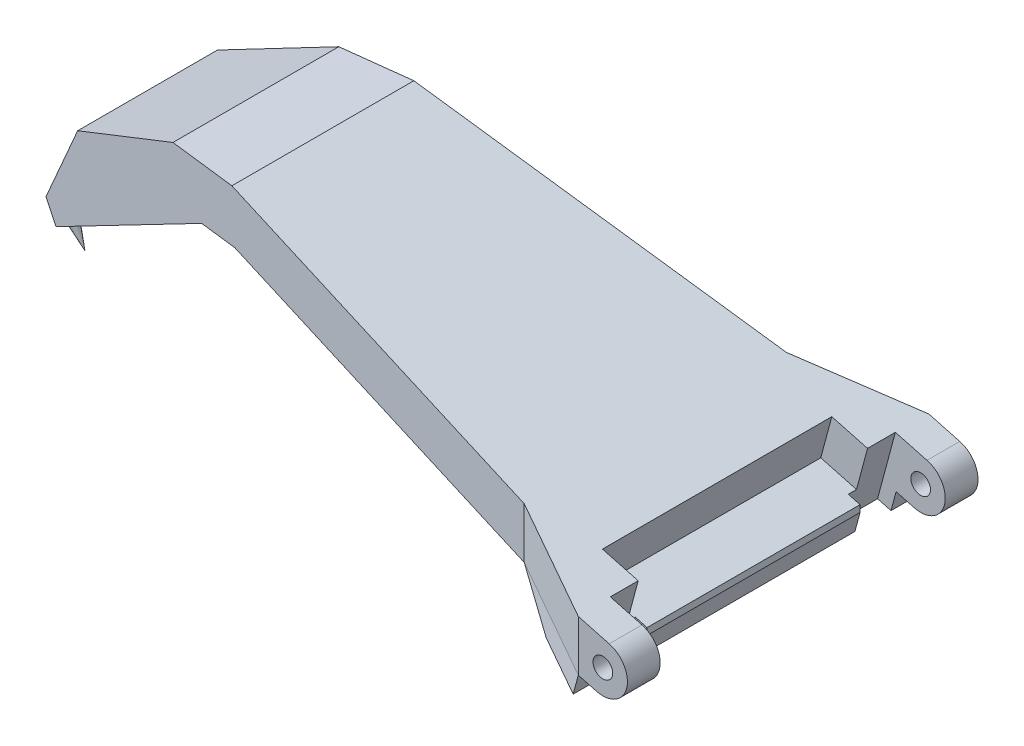
from build123d import *

# Parameters (mm, degrees)
BOSS_EXTRUDE2_DEPTH                  = 26.75
BOSS_EXTRUDE2_DEPTH_BACK             = 26.75
SKETCH3_R                            = 1.5
TOP_FORM_DEPTH                       = 108.569617744
TOP_FORM_DEPTH_BACK                  = 108.569617744
SKETCH12_OUTSIDE_W                   = 131.712
SKETCH12_OUTSIDE_H                   = 79.73
END_EXTRUDE_DEPTH                    = 26.75
END_EXTRUDE_DEPTH_BACK               = 26.75
SKETCH13_R                           = 1.5
SPRING_PHALANX_PLACE_DEPTH           = 8.038475773
SPRING_SUPPORT_DEPTH                 = 3
SPRING_SUPPORT_CORNER_CUT_DEPTH      = 108.569617744
SPRING_SUPPORT_CORNER_CUT_DEPTH_BACK = 108.569617744
SPRING_PLACE_CUT_DEPTH               = 17.5
SPRING_PLACE_CUT_DEPTH_BACK          = 17.5
PHALANX_SPACE_CUT_DEPTH              = 108.487219822
PHALANX_SPACE_CUT_DEPTH_BACK         = 108.487219822


with BuildPart() as part:
    # Sketch3 → Boss-Extrude2 (new, two sides: drawn at the far end of the back side and taken through both)
    with BuildSketch(Plane.XY.offset(-BOSS_EXTRUDE2_DEPTH_BACK)):
        with BuildLine():
            Line((0.970571419, 3.622221849), (-69.482255776, 22.5))
            Line((-69.482255776, 22.5), (-79.701126542, 22.5))
            Line((-79.701126542, 22.5), (-96.234008051, 14.790590741))
            Line((-96.234008051, 14.790590741), (-101.732050808, 3))
            Line((-101.732050808, 3), (-100, 0))
            Line((-100, 0), (-74.714962449, 14.598323237))
            Line((-74.714962449, 14.598323237), (-68.970571419, 14.598323237))
            Line((-68.970571419, 14.598323237), (-0.970571419, -3.622221849))
            ThreePointArc((-0.970571419, -3.622221849), (3.622221849, -0.970571419), (0.970571419, 3.622221849))
        make_face()
        Circle(SKETCH3_R, mode=Mode.SUBTRACT)
    extrude(amount=BOSS_EXTRUDE2_DEPTH + BOSS_EXTRUDE2_DEPTH_BACK)

    # Sketch12 outside → top-form (cut, two sides: drawn at the far end of the back side and taken through both)
    with BuildSketch(Plane(origin=(0, 0, 0), x_dir=(1, 0, 0), z_dir=(0, 1, 0)).offset(-TOP_FORM_DEPTH_BACK)):
        with Locations((-48.991, 0)):
            Rectangle(SKETCH12_OUTSIDE_W, SKETCH12_OUTSIDE_H)
        Polygon((-101.732050808, 10), (-101.732050808, -10), (-18.75, -20), (-3.75, -26.75), (-3.75, 26.75), (-18.75, 20), align=None, mode=Mode.SUBTRACT)
    extrude(amount=TOP_FORM_DEPTH + TOP_FORM_DEPTH_BACK, mode=Mode.SUBTRACT)

    # Sketch13 → end-extrude (add, two sides: drawn at the far end of the back side and taken through both)
    with BuildSketch(Plane.XY.offset(-END_EXTRUDE_DEPTH_BACK)):
        with BuildLine():
            Line((-3.75, 4.887095148), (-3.75, -2.877476205))
            Line((-3.75, -2.877476205), (-0.970571419, -3.622221849))
            ThreePointArc((-0.970571419, -3.622221849), (3.622221849, -0.970571419), (0.970571419, 3.622221849))
            Line((0.970571419, 3.622221849), (-3.75, 4.887095148))
        make_face()
        Circle(SKETCH13_R, mode=Mode.SUBTRACT)
    extrude(amount=END_EXTRUDE_DEPTH + END_EXTRUDE_DEPTH_BACK)

    # Sketch16 → spring_phalanx_place (cut, along a direction that is not the sketch's normal)
    with BuildSketch(Plane(origin=(0.970571419, 3.622221849, 0), x_dir=(0.9659258262890683, -0.2588190451025211, 0), z_dir=(0.2588190451025211, 0.9659258262890683, 0))):
        Polygon((-4.887095148, 0), (-4.887095148, -21.75), (0, -21.75), (0, 21.75), (-4.887095148, 21.75), align=None)
        Polygon((0, 21.75), (0, -21.75), (3.75, -21.75), (3.75, 0), (3.75, 21.75), align=None)
    extrude(amount=-SPRING_PHALANX_PLACE_DEPTH, dir=(0, 1, 0), mode=Mode.SUBTRACT)

    # spikes cone 1 section (through the dimple's axis) → spikes (revolve)
    with BuildSketch(Plane(origin=(-98.700961894, 0.75, 8.857123826), x_dir=(0, 0, 1), z_dir=(0.866025404, 0.5, 0))):
        Polygon((0, 0), (0.75, 0), (0, 3.528472582), align=None)
    revolve(axis=Axis((-98.700961894, 0.75, 8.857123826), (0.5, -0.866025404, 0)))

    # spikes cone 2 section (through the dimple's axis) → spikes cone 2 (revolve)
    with BuildSketch(Plane(origin=(-98.700961894, 0.75, -8.857123826), x_dir=(0, 0, 1), z_dir=(0.866025404, 0.5, 0))):
        Polygon((0, 0), (0.75, 0), (0, 3.528472582), align=None)
    revolve(axis=Axis((-98.700961894, 0.75, -8.857123826), (0.5, -0.866025404, 0)))

    # Sketch18 → spring-support (add)
    with BuildSketch(Plane(origin=(-0.970571419, -3.622221849, 0), x_dir=(0.9659258262890681, -0.2588190451025214, 0), z_dir=(-0.2588190451025214, -0.9659258262890681, 0))):
        Polygon((-2.877476205, 21.75), (-2.877476205, 26.75), (-18.406618911, 20), (-18.406618911, -20), (-2.877476205, -26.75), (-2.877476205, -21.75), align=None)
    extrude(amount=SPRING_SUPPORT_DEPTH)

    # Sketch22 → spring-support-corner-cut (cut, two sides: drawn at the far end of the back side and taken through both)
    with BuildSketch(Plane.XY.offset(-SPRING_SUPPORT_CORNER_CUT_DEPTH_BACK)):
        Polygon((-19.526457135, -1.756015797), (-18.75, 1.141761682), (-12.026457135, -3.765634741), align=None)
    extrude(amount=SPRING_SUPPORT_CORNER_CUT_DEPTH + SPRING_SUPPORT_CORNER_CUT_DEPTH_BACK, mode=Mode.SUBTRACT)

    # Sketch22<3> → spring-place-cut (cut, two sides: drawn at the far end of the back side and taken through both)
    with BuildSketch(Plane.XY.offset(-SPRING_PLACE_CUT_DEPTH_BACK)):
        Polygon((-3.75, -1.842200025), (-10.994443697, 0.098942814), (-8.406253246, 9.758201077), (-3.75, 8.51056178), align=None)
    extrude(amount=SPRING_PLACE_CUT_DEPTH + SPRING_PLACE_CUT_DEPTH_BACK, mode=Mode.SUBTRACT)

    # Sketch21 → phalanx-space-cut (cut, two sides: drawn at the far end of the back side and taken through both)
    with BuildSketch(Plane(origin=(-0.711752374, -2.656296022, 0), x_dir=(0.9659258262890681, -0.2588190451025214, 0), z_dir=(0.2588190451025214, 0.9659258262890681, 0)).offset(-PHALANX_SPACE_CUT_DEPTH_BACK)):
        Polygon((-4.887095148, 21.75), (0, 21.75), (0, 16.25), (-5, 16.25), (-5, 21.75), align=None)
        Polygon((-4.887095148, -21.75), (-5, -21.75), (-5, -16.25), (0, -16.25), (0, -21.75), align=None)
    extrude(amount=PHALANX_SPACE_CUT_DEPTH + PHALANX_SPACE_CUT_DEPTH_BACK, mode=Mode.SUBTRACT)


solid = part.part
